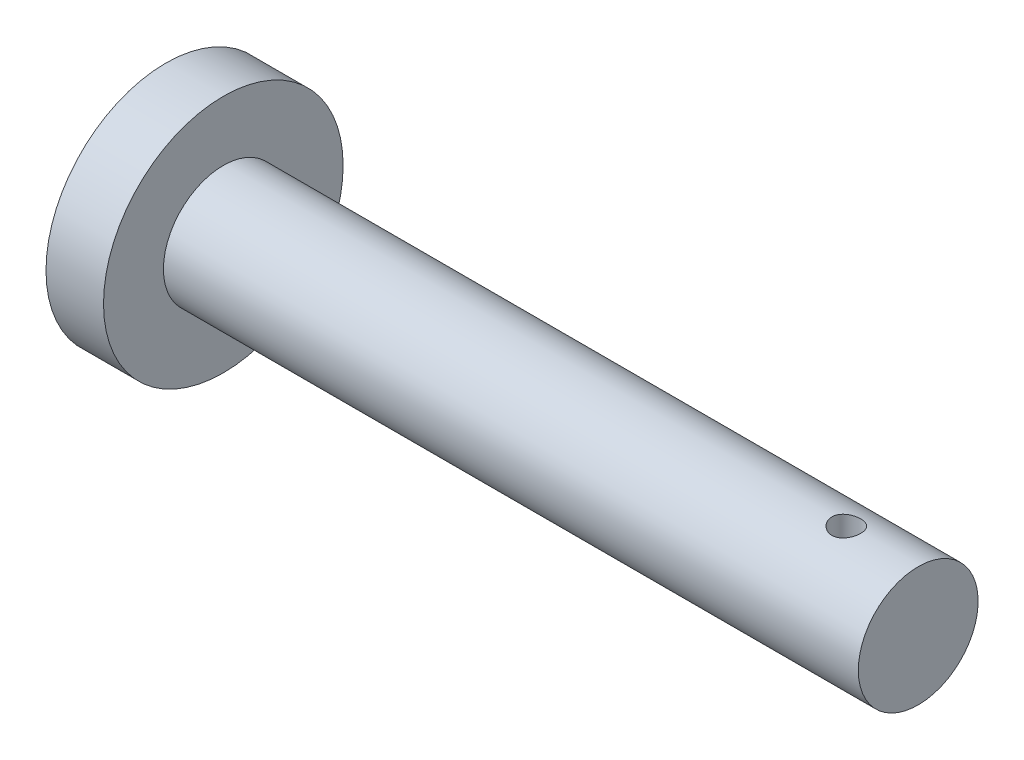
from build123d import *

# Parameters (mm, degrees)
CUT_EXTRUDE1_DEPTH      = 161.931662515
CUT_EXTRUDE1_DEPTH_BACK = 161.931662515
SKETCH2_R               = 3


with BuildPart() as part:
    # Sketch1 → Revolve1 (revolve)
    with BuildSketch(Plane.XY, mode=Mode.PRIVATE) as revolve1_sk:
        Polygon((0, 0), (0, 12.5), (-145, 12.5), (-145, 25), (-157, 25), (-157, 0), align=None)
    revolve(revolve1_sk.sketch.rotate(Axis((-157, 0, 0), (1, 0, 0)), 90), axis=Axis((-157, 0, 0), (1, 0, 0)))

    # Sketch2 → Cut-Extrude1 (cut, two sides: drawn at the far end of the back side and taken through both)
    with BuildSketch(Plane(origin=(0, 0, 0), x_dir=(1, 0, 0), z_dir=(0, 1, 0)).offset(-CUT_EXTRUDE1_DEPTH_BACK)):
        with Locations(Location((-15, 0, 0), (0, 0, 270))):
            Circle(SKETCH2_R)
    extrude(amount=CUT_EXTRUDE1_DEPTH + CUT_EXTRUDE1_DEPTH_BACK, mode=Mode.SUBTRACT)


solid = part.part
